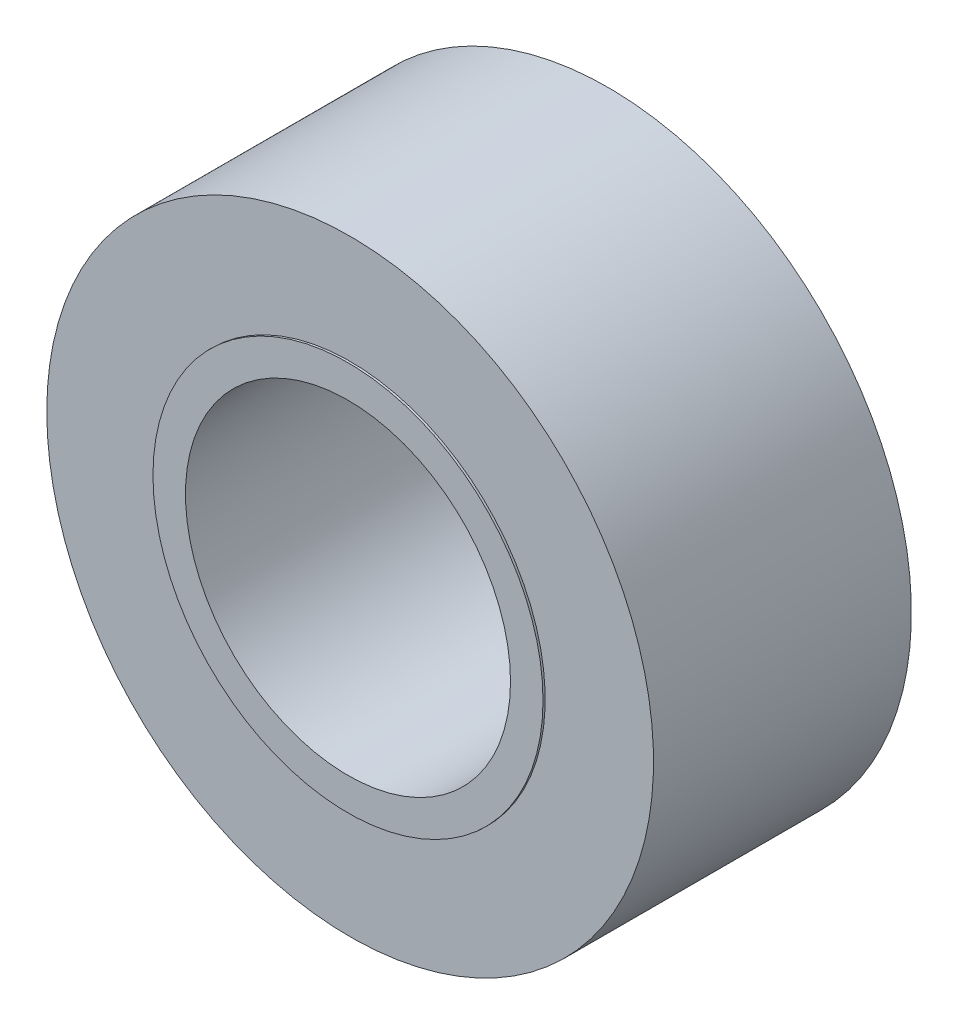
from build123d import *

# Parameters (mm, degrees)
CROQUIS1_R                   = 9
CROQUIS1_R_2                 = 7.5
SALIENTE_EXTRUIR1_DEPTH      = 12
SALIENTE_EXTRUIR2_DEPTH      = 1
SALIENTE_EXTRUIR2_DEPTH_BACK = 0.1
CROQUIS2_R                   = 7.5
CROQUIS3_R                   = 5.2
CROQUIS3_R_2                 = 1.5
SALIENTE_EXTRUIR4_DEPTH      = 3
CROQUIS4_R                   = 14
CROQUIS4_R_2                 = 9
SALIENTE_EXTRUIR5_DEPTH      = 11.9
CORTAR_EXTRUIR1_START        = -15
CROQUIS6_R                   = 1.5
CORTAR_EXTRUIR1_DEPTH        = 15


with BuildPart() as part:
    # Croquis1 → Saliente-Extruir1 (new body)
    with BuildSketch(Plane.XY):
        Circle(CROQUIS1_R)
        Circle(CROQUIS1_R_2, mode=Mode.SUBTRACT)
    extrude(amount=SALIENTE_EXTRUIR1_DEPTH)

    # Croquis2 → Saliente-Extruir2 (add, two sides: drawn at the far end of the back side and taken through both)
    with BuildSketch(Plane.XY.offset(-SALIENTE_EXTRUIR2_DEPTH_BACK)):
        Circle(CROQUIS2_R)
    extrude(amount=SALIENTE_EXTRUIR2_DEPTH + SALIENTE_EXTRUIR2_DEPTH_BACK)

    # Croquis3 → Saliente-Extruir4 (add)
    with BuildSketch(Plane.XY):
        Circle(CROQUIS3_R)
        Circle(CROQUIS3_R_2, mode=Mode.SUBTRACT)
    extrude(amount=-SALIENTE_EXTRUIR4_DEPTH)

    # Croquis4 → Saliente-Extruir5 (add)
    with BuildSketch(Plane(origin=(0, 0, 0), x_dir=(-1, 0, 0), z_dir=(0, 0, -1))):
        Circle(CROQUIS4_R)
        Circle(CROQUIS4_R_2, mode=Mode.SUBTRACT)
    extrude(amount=-SALIENTE_EXTRUIR5_DEPTH)

    # Croquis6 → Cortar-Extruir1 (cut)
    with BuildSketch(Plane(origin=(0, 0, -3), x_dir=(-1, 0, 0), z_dir=(0, 0, -1)).offset(CORTAR_EXTRUIR1_START)):
        with Locations(Location((0, 0, 0), (0, 0, 180))):
            Circle(CROQUIS6_R)
    extrude(amount=CORTAR_EXTRUIR1_DEPTH, mode=Mode.SUBTRACT)


solid = part.part
